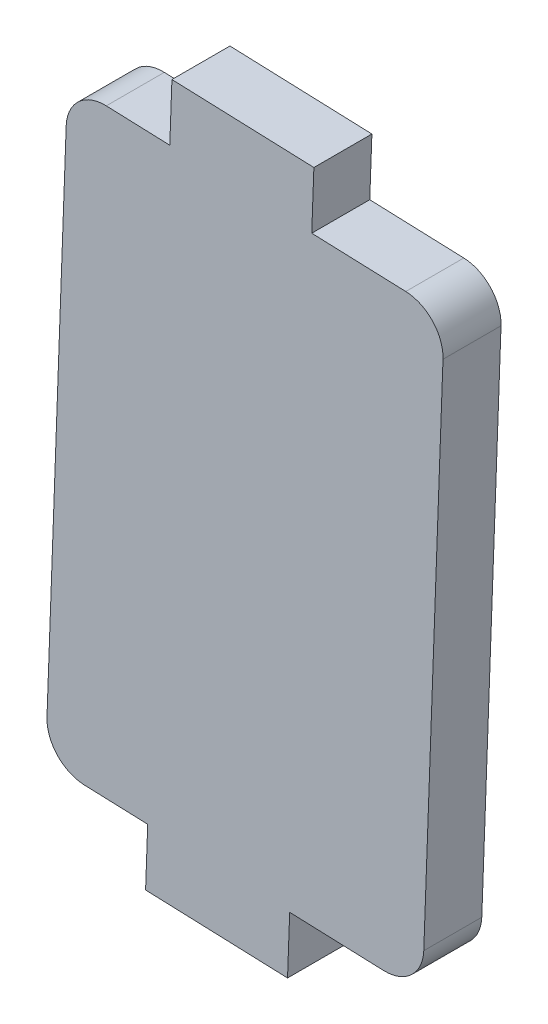
from build123d import *

# Parameters (mm, degrees)
BASE_EXTRUDE_DEPTH = 3


with BuildPart() as part:
    # Sketch1 → Base-Extrude (new body)
    with BuildSketch(Plane.XY):
        with BuildLine():
            Line((701.562436995, 484.642265501), (701.672859679, 487.640232618))
            Line((701.672859679, 487.640232618), (698.38928136, 487.761175083))
            ThreePointArc((698.38928136, 487.761175083), (696.997587478, 488.398618328), (696.464251738, 489.83343495))
            Line((696.464251738, 489.83343495), (697.458055899, 516.815138997))
            ThreePointArc((697.458055899, 516.815138997), (698.095499144, 518.206832879), (699.530315766, 518.740168618))
            Line((699.530315766, 518.740168618), (702.813894085, 518.619226153))
            Line((702.813894085, 518.619226153), (702.92431677, 521.61719327))
            Line((702.92431677, 521.61719327), (710.26431677, 521.346842571))
            Line((710.26431677, 521.346842571), (710.153894085, 518.348875455))
            Line((710.153894085, 518.348875455), (715.015630112, 518.169805464))
            ThreePointArc((715.015630112, 518.169805464), (716.407323993, 517.532362219), (716.940659733, 516.097545597))
            Line((716.940659733, 516.097545597), (715.946855573, 489.11584155))
            ThreePointArc((715.946855573, 489.11584155), (715.309412328, 487.724147668), (713.874595706, 487.190811929))
            Line((713.874595706, 487.190811929), (709.012859679, 487.369881919))
            Line((709.012859679, 487.369881919), (708.902436995, 484.371914803))
            Line((708.902436995, 484.371914803), (701.562436995, 484.642265501))
        make_face()
    extrude(amount=BASE_EXTRUDE_DEPTH)


solid = part.part
